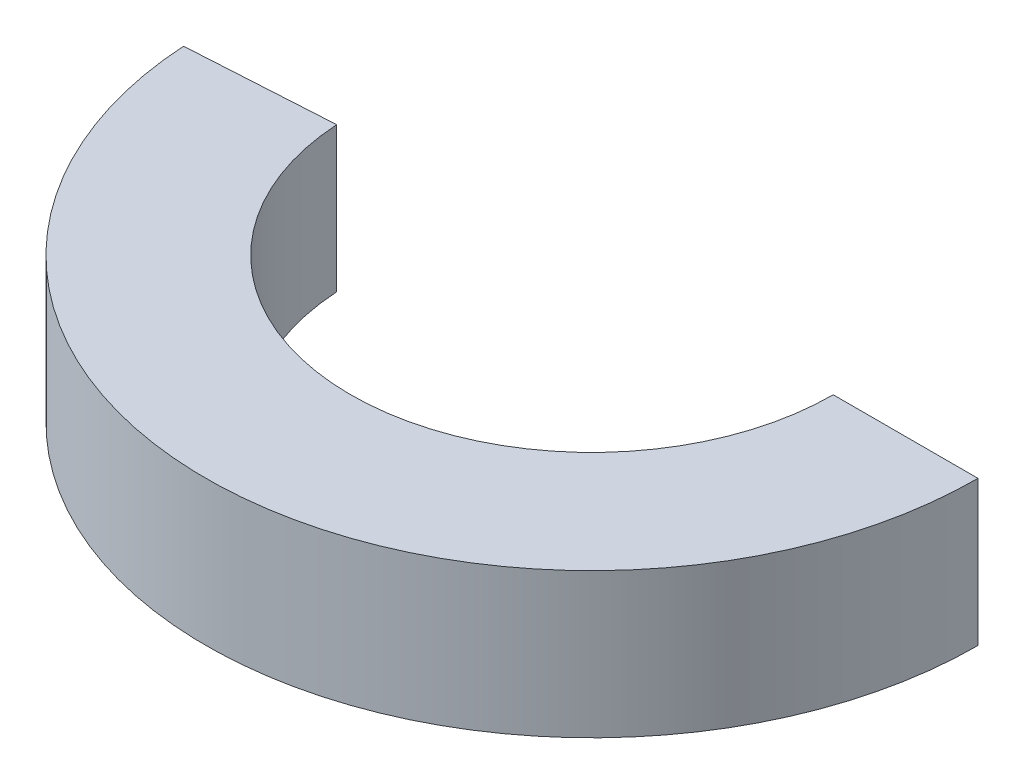
from build123d import *

# Parameters (mm, degrees)
BOSS_EXTRUDE1_DEPTH = 15


with BuildPart() as part:
    # Sketch1 → Boss-Extrude1 (new body)
    with BuildSketch(Plane(origin=(0, 0, 0), x_dir=(1, 0, 0), z_dir=(0, 1, 0))):
        with BuildLine():
            Line((-24.955736545, -1.48701496), (-39.929178472, -2.379223936))
            ThreePointArc((-39.929178472, -2.379223936), (1.190138881, -39.982290698), (40, 0))
            Line((40, 0), (25, 0))
            ThreePointArc((25, 0), (0.743836801, -24.988931686), (-24.955736545, -1.48701496))
        make_face()
    extrude(amount=BOSS_EXTRUDE1_DEPTH)


solid = part.part
